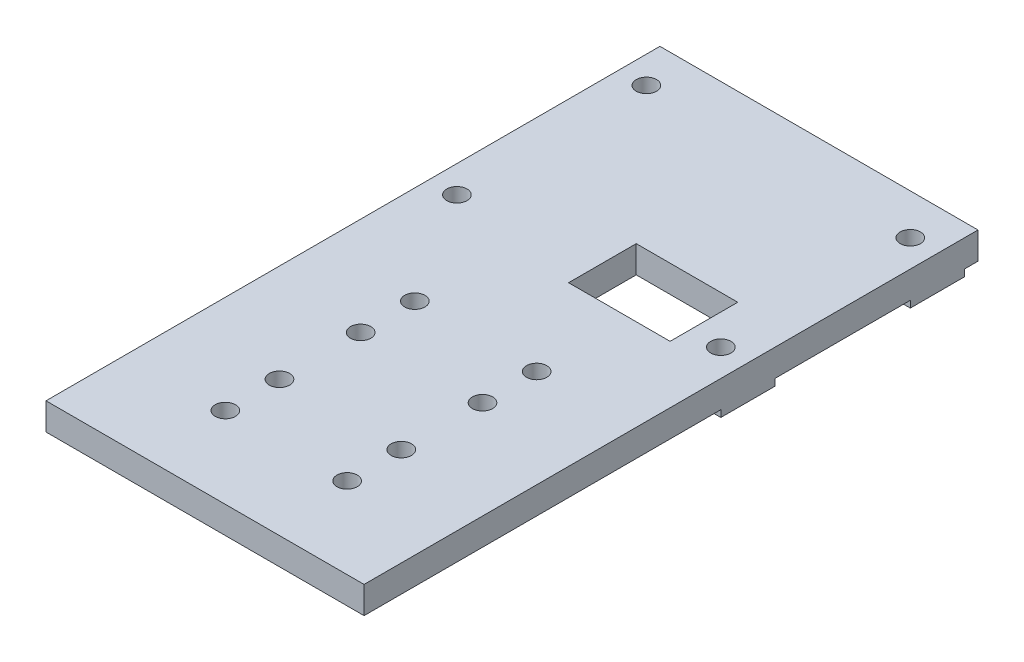
from build123d import *
from build123d.topology import SkipClean

# Parameters (mm, degrees)
SKETCH_1_W          = 47
SKETCH_1_H          = 40
SKETCH_1_R          = 1.5
SKETCH_1_W_2        = 30
SKETCH_1_H_2        = 10
SKETCH_1_H_3        = 55.72
SKETCH_1_W_3        = 15
EXTRUDE_1_DEPTH     = 4
EXTRUDE_START       = 1
SKETCH_3_W          = 8
SKETCH_3_H          = 8
SKETCH_3_R          = 1.5
EXTRUDE_2_DEPTH     = 1
SKETCH_4_R          = 1.5
SKETCH_4_W          = 47
SKETCH_4_H          = 5
CUT_EXTRUDE_2_DEPTH = 4


with BuildPart() as part:
    # 草图1 → 凸台-拉伸1 (new body)
    # profile 1 of 3: a face of its own
    with BuildSketch(Plane(origin=(0, 0, 0), x_dir=(1, 0, 0), z_dir=(0, 1, 0))):
        Rectangle(SKETCH_1_W, SKETCH_1_H)
        with Locations(Location((19.5, -14, 0), (0, 0, 270))):
            Circle(SKETCH_1_R, mode=Mode.SUBTRACT)
        with Locations(Location((19.5, 14, 0), (0, 0, 270))):
            Circle(SKETCH_1_R, mode=Mode.SUBTRACT)
        with Locations(Location((-19.5, -14, 0), (0, 0, 270))):
            Circle(SKETCH_1_R, mode=Mode.SUBTRACT)
        with Locations(Location((-19.5, 14, 0), (0, 0, 270))):
            Circle(SKETCH_1_R, mode=Mode.SUBTRACT)
        with Locations((0, -12)):
            Rectangle(SKETCH_1_W_2, SKETCH_1_H_2, mode=Mode.SUBTRACT)
    # profile 2 of 3: a face of its own
    with BuildSketch(Plane(origin=(0, 0, 0), x_dir=(1, 0, 0), z_dir=(0, 1, 0))):
        with Locations((0, -47.86)):
            Rectangle(SKETCH_1_W, SKETCH_1_H_3)
    # profile 3 of 3: a face of its own
    with BuildSketch(Plane(origin=(0, 0, 0), x_dir=(1, 0, 0), z_dir=(0, 1, 0))):
        with Locations((-7.5, -12)):
            Rectangle(SKETCH_1_W_3, SKETCH_1_H_2)
    extrude(amount=EXTRUDE_1_DEPTH)

    # 草图3 → 凸台-拉伸2 (add)
    # profile 1 of 4: a face of its own
    with SkipClean():  # the faces are left unmerged after this step: merging them gives an invalid solid
        with BuildSketch(Plane.XZ.offset(EXTRUDE_START)):
            with Locations((19.5, -14)):
                Rectangle(SKETCH_3_W, SKETCH_3_H)
            with Locations(Location((19.5, -14, 0), (0, 0, 270))):
                Circle(SKETCH_3_R, mode=Mode.SUBTRACT)
        # profile 2 of 4: a face of its own
        with BuildSketch(Plane.XZ.offset(EXTRUDE_START)):
            with Locations((19.5, 14)):
                Rectangle(SKETCH_3_W, SKETCH_3_H)
            with Locations(Location((19.5, 14, 0), (0, 0, 270))):
                Circle(SKETCH_3_R, mode=Mode.SUBTRACT)
        # profile 3 of 4: a face of its own
        with BuildSketch(Plane.XZ.offset(EXTRUDE_START)):
            with Locations((-19.5, -14)):
                Rectangle(SKETCH_3_W, SKETCH_3_H)
            with Locations(Location((-19.5, -14, 0), (0, 0, 270))):
                Circle(SKETCH_3_R, mode=Mode.SUBTRACT)
        # profile 4 of 4: a face of its own
        with BuildSketch(Plane.XZ.offset(EXTRUDE_START)):
            with Locations((-19.5, 14)):
                Rectangle(SKETCH_3_W, SKETCH_3_H)
            with Locations(Location((-19.5, 14, 0), (0, 0, 270))):
                Circle(SKETCH_3_R, mode=Mode.SUBTRACT)
        extrude(amount=-EXTRUDE_2_DEPTH)

    # 草图4 → 切除-拉伸2 (cut)
    with SkipClean():  # the faces are left unmerged after this step: merging them gives an invalid solid
        with BuildSketch(Plane(origin=(0, 4, 0), x_dir=(1, 0, 0), z_dir=(0, 1, 0))):
            with Locations(Location((9, -30.72, 0), (0, 0, 270))):
                Circle(SKETCH_4_R)
            with Locations(Location((9, -50.72, 0), (0, 0, 270))):
                Circle(SKETCH_4_R)
            with Locations(Location((-9, -50.72, 0), (0, 0, 90))):
                Circle(SKETCH_4_R)
            with Locations(Location((-9, -30.72, 0), (0, 0, 90))):
                Circle(SKETCH_4_R)
            with Locations(Location((-9, -38.72, 0), (0, 0, 90))):
                Circle(SKETCH_4_R)
            with Locations(Location((9, -38.72, 0), (0, 0, 270))):
                Circle(SKETCH_4_R)
            with Locations(Location((9, -58.72, 0), (0, 0, 270))):
                Circle(SKETCH_4_R)
            with Locations(Location((-9, -58.72, 0), (0, 0, 90))):
                Circle(SKETCH_4_R)
            with Locations((0, -73.22)):
                Rectangle(SKETCH_4_W, SKETCH_4_H)
        extrude(amount=-CUT_EXTRUDE_2_DEPTH, mode=Mode.SUBTRACT)


solid = part.part
